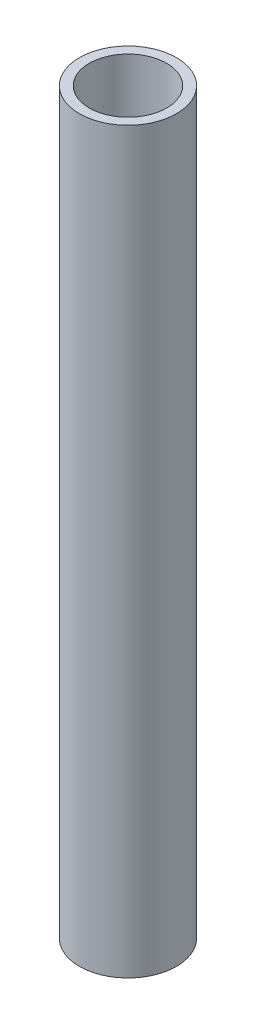
from build123d import *

# Parameters (mm, degrees)
SKETCH1_R           = 16.7005
SKETCH1_R_2         = 13.3223
BOSS_EXTRUDE1_DEPTH = 254


with BuildPart() as part:
    # Sketch1 → Boss-Extrude1 (new body)
    with BuildSketch(Plane(origin=(0, 0, 0), x_dir=(1, 0, 0), z_dir=(0, 1, 0))):
        with Locations(Location((0, 0, 0), (0, 0, 270))):
            Circle(SKETCH1_R)
        with Locations(Location((0, 0, 0), (0, 0, 270))):
            Circle(SKETCH1_R_2, mode=Mode.SUBTRACT)
    extrude(amount=BOSS_EXTRUDE1_DEPTH)


solid = part.part
